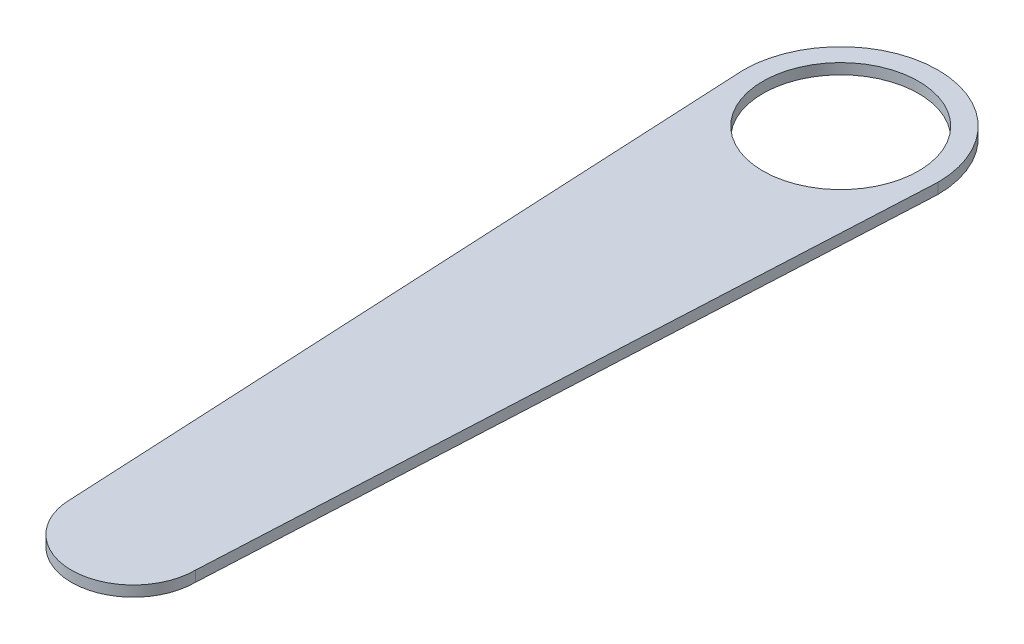
from build123d import *

# Parameters (mm, degrees)
SKETCH1_R           = 17.5
BOSS_EXTRUDE1_DEPTH = 3
SKETCH2_R           = 22
CUT_EXTRUDE1_DEPTH  = 220.25213796


with BuildPart() as part:
    # Sketch1 → Boss-Extrude1 (new body)
    with BuildSketch(Plane(origin=(0, 0, 0), x_dir=(1, 0, 0), z_dir=(0, 1, 0))):
        with BuildLine():
            ThreePointArc((27.5, 0), (0, 27.5), (-27.5, 0))
            Line((-27.5, 0), (-27.362842893, -2.743142145))
            ThreePointArc((-27.362842893, -2.743142145), (0, -27.5), (27.362842893, -2.743142145))
            Line((27.362842893, -2.743142145), (27.5, 0))
        make_face()
        with BuildLine():
            ThreePointArc((27.362842893, -2.743142145), (0, -27.5), (-27.362842893, -2.743142145))
            Line((-27.362842893, -2.743142145), (-17.5, -200))
            ThreePointArc((-17.5, -200), (0, -182.5), (17.5, -200))
            Line((17.5, -200), (27.362842893, -2.743142145))
        make_face()
        with Locations((0, -200)):
            Circle(SKETCH1_R)
    extrude(amount=BOSS_EXTRUDE1_DEPTH)

    # Sketch2 → Cut-Extrude1 (cut, through all)
    with BuildSketch(Plane(origin=(0, 3, 0), x_dir=(1, 0, 0), z_dir=(0, 1, 0))):
        with Locations(Location((0, 0, 0), (0, 0, 270))):
            Circle(SKETCH2_R)
    extrude(amount=-CUT_EXTRUDE1_DEPTH, mode=Mode.SUBTRACT)


solid = part.part
